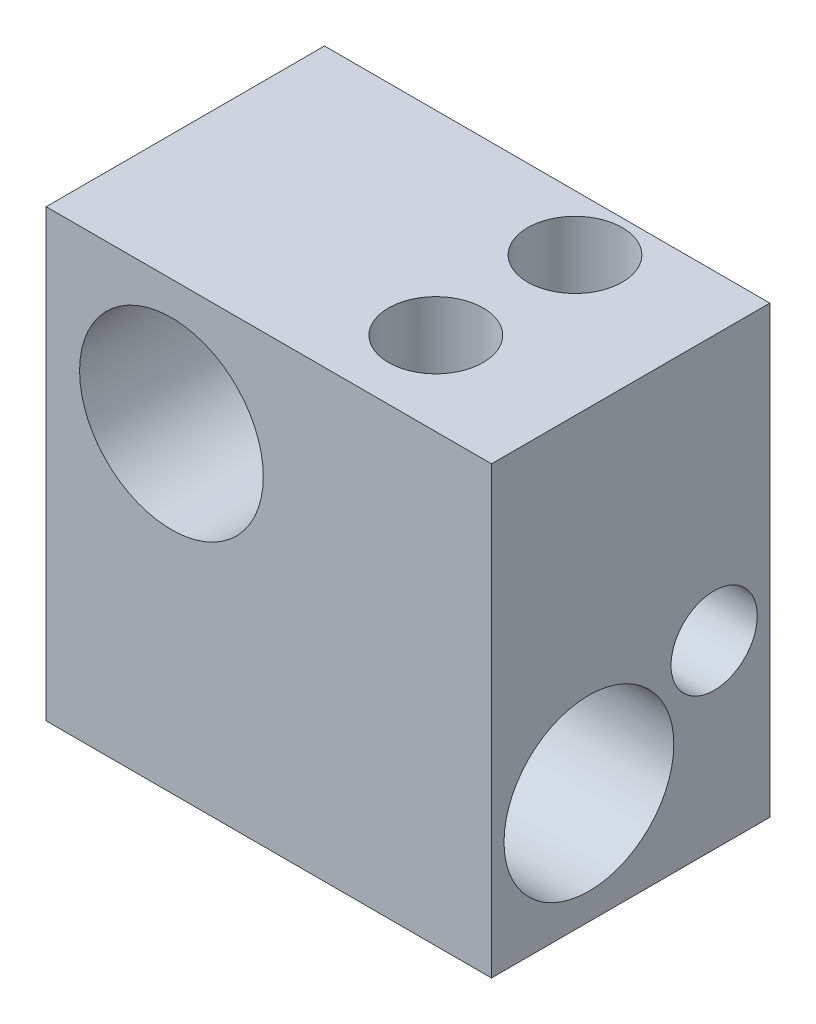
from build123d import *

# Parameters (mm, degrees)
ESQUISSE1_W                     = 16
ESQUISSE1_H                     = 16
BOSS_EXTRU_1_DEPTH              = 10
D_GAGEMENT_M61_D                = 6.6
DIAM_TRE_DU_PER_AGE_6_1_6_1_1_D = 6.1
DIAM_TRE_DU_PER_AGE_3_1_3_1_1_D = 3.1
D_GAGEMENT_M31_D                = 3.4
D_GAGEMENT_M31_DEPTH            = 11
D_GAGEMENT_M31_TIP              = 1.021463052
D_GAGEMENT_M33_D                = 3.4
D_GAGEMENT_M33_DEPTH            = 9.5
D_GAGEMENT_M33_TIP              = 1.021463052


with BuildPart() as part:
    # Esquisse1 → Boss.-Extru.1 (new body)
    with BuildSketch(Plane.XY):
        with Locations((8, 8)):
            Rectangle(ESQUISSE1_W, ESQUISSE1_H)
    extrude(amount=BOSS_EXTRU_1_DEPTH)

    # Dégagement M61 (through all)
    with Locations(Plane.XY.offset(10)):
        with Locations((4.5, 11.5)):
            Hole(D_GAGEMENT_M61_D / 2)

    # Diamètre du perçage Ø6.1 (6.1)1 (through all)
    with Locations(Plane(origin=(16, 0, 0), x_dir=(0, 0, -1), z_dir=(1, 0, 0))):
        with Locations((-6.5, 4)):
            Hole(DIAM_TRE_DU_PER_AGE_6_1_6_1_1_D / 2)

    # Diamètre du perçage Ø3.1 (3.1)1 (through all)
    with Locations(Plane(origin=(16, 0, 0), x_dir=(0, 0, -1), z_dir=(1, 0, 0))):
        with Locations((-2, 6.5)):
            Hole(DIAM_TRE_DU_PER_AGE_3_1_3_1_1_D / 2)

    # Dégagement M31
    with Locations(Plane(origin=(0, 16, 0), x_dir=(1, 0, 0), z_dir=(0, 1, 0))):
        with Locations((11, -7)):
            Hole(D_GAGEMENT_M31_D / 2, depth=D_GAGEMENT_M31_DEPTH)
            with Locations((0, 0, -(D_GAGEMENT_M31_DEPTH + D_GAGEMENT_M31_TIP / 2))):  # 118° drill point
                Cone(0, D_GAGEMENT_M31_D / 2, D_GAGEMENT_M31_TIP, mode=Mode.SUBTRACT)

    # Dégagement M33
    with Locations(Plane(origin=(0, 16, 0), x_dir=(1, 0, 0), z_dir=(0, 1, 0))):
        with Locations((11, -2)):
            Hole(D_GAGEMENT_M33_D / 2, depth=D_GAGEMENT_M33_DEPTH)
            with Locations((0, 0, -(D_GAGEMENT_M33_DEPTH + D_GAGEMENT_M33_TIP / 2))):  # 118° drill point
                Cone(0, D_GAGEMENT_M33_D / 2, D_GAGEMENT_M33_TIP, mode=Mode.SUBTRACT)


solid = part.part
